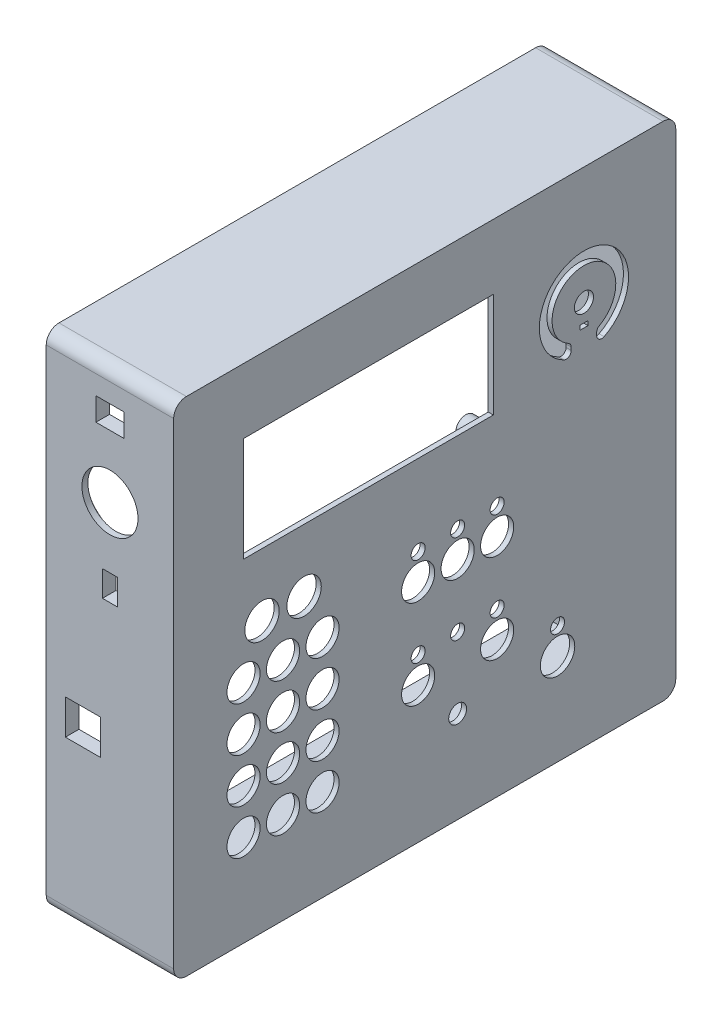
from build123d import *

# Parameters (mm, degrees)
SKETCH1_W           = 197
SKETCH1_H           = 197
BOSS_EXTRUDE1_DEPTH = 50
SKETCH6_W           = 187
SKETCH6_H           = 187
CUT_EXTRUDE1_DEPTH  = 48
SKETCH8_W           = 98
SKETCH8_H           = 41
CUT_EXTRUDE2_DEPTH  = 25
SKETCH9_R           = 4
BOSS_EXTRUDE2_DEPTH = 6.5
FILLET3_R           = 1
SKETCH15_R          = 6.5
SKETCH15_R_2        = 6.75
SKETCH15_R_3        = 2.75
SKETCH15_R_4        = 3.5
CUT_EXTRUDE7_DEPTH  = 10
SKETCH12_R          = 3.75
SKETCH12_W          = 3.2
SKETCH12_H          = 1.7
CUT_EXTRUDE8_DEPTH  = 10
SKETCH18_R          = 11
CUT_EXTRUDE10_DEPTH = 6
SKETCH19_W          = 11
SKETCH19_H          = 9
SKETCH19_W_2        = 5.9
SKETCH19_H_2        = 10.1
CUT_EXTRUDE11_DEPTH = 6
FILLET6_R           = 2
SKETCH21_R          = 2.45
BOSS_EXTRUDE4_DEPTH = 5
FILLET7_R           = 5
SKETCH22_W          = 13.7
SKETCH22_H          = 13.7
CUT_EXTRUDE14_DEPTH = 10
SKETCH27_R          = 15.105421197
CUT_EXTRUDE17_DEPTH = 3
SKETCH28_R          = 2.35
CUT_EXTRUDE18_DEPTH = 6.5


with BuildPart() as part:
    # Sketch1 → Boss-Extrude1 (new body)
    with BuildSketch(Plane(origin=(0, 0, 0), x_dir=(0, 0, -1), z_dir=(1, 0, 0))):
        with Locations((-204.789321881, 0)):
            Rectangle(SKETCH1_W, SKETCH1_H)
    extrude(amount=BOSS_EXTRUDE1_DEPTH)

    # Sketch6 → Cut-Extrude1 (cut)
    with BuildSketch(Plane(origin=(0, 0, 0), x_dir=(0, 0, -1), z_dir=(1, 0, 0))):
        with Locations((-204.449739467, 0)):
            Rectangle(SKETCH6_W, SKETCH6_H)
    extrude(amount=CUT_EXTRUDE1_DEPTH, mode=Mode.SUBTRACT)

    # Sketch8 → Cut-Extrude2 (cut)
    with BuildSketch(Plane.ZY.offset(-48)):
        with Locations((226.869321881, 52.5)):
            Rectangle(SKETCH8_W, SKETCH8_H)
    extrude(amount=-CUT_EXTRUDE2_DEPTH, mode=Mode.SUBTRACT)

    # Sketch9 → Boss-Extrude2 (add)
    with BuildSketch(Plane.ZY.offset(-48)):
        with Locations(Location((180.119321881, 25, 0), (0, 0, 180))):
            Circle(SKETCH9_R)
        with Locations(Location((180.119321881, 80, 0), (0, 0, 180))):
            Circle(SKETCH9_R)
        with Locations(Location((273.619321881, 80, 0), (0, 0, 180))):
            Circle(SKETCH9_R)
        with Locations(Location((273.619321881, 25, 0), (0, 0, 180))):
            Circle(SKETCH9_R)
    extrude(amount=BOSS_EXTRUDE2_DEPTH)

    # Fillet3
    fillet3_edges = [part.edges().sort_by_distance(p)[0] for p in [
        (48, 25, 184.119321881),
        (48, 80, 184.119321881),
        (48, 80, 277.619321881),
        (48, 25, 277.619321881),
    ]]
    fillet(fillet3_edges, radius=FILLET3_R)

    # Sketch15 → Cut-Extrude7 (cut)
    with BuildSketch(Plane(origin=(50, 0, 0), x_dir=(0, 0, -1), z_dir=(1, 0, 0))):
        with Locations((-275.871904419, -62.5)):
            Circle(SKETCH15_R)
        with Locations((-275.871904419, -45)):
            Circle(SKETCH15_R)
        with Locations((-275.871904419, -27.5)):
            Circle(SKETCH15_R)
        with Locations((-275.871904419, -10)):
            Circle(SKETCH15_R)
        with Locations((-260.371904419, -62.5)):
            Circle(SKETCH15_R)
        with Locations((-260.371904419, -45)):
            Circle(SKETCH15_R)
        with Locations((-260.371904419, -27.5)):
            Circle(SKETCH15_R)
        with Locations((-260.371904419, -10)):
            Circle(SKETCH15_R)
        with Locations((-244.871904419, -62.5)):
            Circle(SKETCH15_R)
        with Locations((-244.871904419, -45)):
            Circle(SKETCH15_R)
        with Locations((-244.871904419, -27.5)):
            Circle(SKETCH15_R)
        with Locations((-244.871904419, -10)):
            Circle(SKETCH15_R)
        with Locations((-268.621904419, 7.5)):
            Circle(SKETCH15_R_2)
        with Locations((-252.121904419, 7.5)):
            Circle(SKETCH15_R_2)
        with Locations((-207.371904419, -10)):
            Circle(SKETCH15_R)
        with Locations((-191.871904419, -10)):
            Circle(SKETCH15_R)
        with Locations((-176.371904419, -10)):
            Circle(SKETCH15_R)
        with Locations((-207.371904419, -45)):
            Circle(SKETCH15_R)
        with Locations((-176.371904419, -45)):
            Circle(SKETCH15_R)
        with Locations((-176.371904419, -34.7)):
            Circle(SKETCH15_R_3)
        with Locations((-207.371904419, -34.7)):
            Circle(SKETCH15_R_3)
        with Locations((-207.371904419, 0.3)):
            Circle(SKETCH15_R_3)
        with Locations((-191.871904419, 0.3)):
            Circle(SKETCH15_R_3)
        with Locations((-176.371904419, 0.3)):
            Circle(SKETCH15_R_3)
        with Locations((-152.671904419, -52.2)):
            Circle(SKETCH15_R_3)
        with Locations((-191.871904419, -62.5)):
            Circle(SKETCH15_R_4)
        with Locations((-191.871904419, -34.7)):
            Circle(SKETCH15_R_3)
        with Locations((-152.671904419, -62.5)):
            Circle(SKETCH15_R_2)
    extrude(amount=-CUT_EXTRUDE7_DEPTH, mode=Mode.SUBTRACT)

    # Sketch12 → Cut-Extrude8 (cut)
    with BuildSketch(Plane(origin=(50, 0, 0), x_dir=(0, 0, -1), z_dir=(1, 0, 0))):
        with Locations((-142.319321881, 52.5)):
            Circle(SKETCH12_R)
        with BuildLine():
            Line((-147.319321881, 35.729490169), (-147.319321881, 41.043560763))
            ThreePointArc((-147.319321881, 41.043560763), (-142.319321881, 65), (-137.319321881, 41.043560763))
            Line((-137.319321881, 41.043560763), (-137.319321881, 35.729490169))
            ThreePointArc((-137.319321881, 35.729490169), (-142.319321881, 70), (-147.319321881, 35.729490169))
        make_face()
        with Locations((-142.319321881, 44.65)):
            Rectangle(SKETCH12_W, SKETCH12_H)
    extrude(amount=-CUT_EXTRUDE8_DEPTH, mode=Mode.SUBTRACT)

    # Sketch18 → Cut-Extrude10 (cut)
    with BuildSketch(Plane.XY.offset(303.289321881)):
        with Locations((25, 52.5)):
            Circle(SKETCH18_R)
    extrude(amount=-CUT_EXTRUDE10_DEPTH, mode=Mode.SUBTRACT)

    # Sketch19 → Cut-Extrude11 (cut)
    with BuildSketch(Plane.XY.offset(303.289321881)):
        with Locations((25, 81.5)):
            Rectangle(SKETCH19_W, SKETCH19_H)
        with Locations((25, 23.5)):
            Rectangle(SKETCH19_W_2, SKETCH19_H_2)
    extrude(amount=-CUT_EXTRUDE11_DEPTH, mode=Mode.SUBTRACT)

    # Fillet6
    fillet6_edges = [part.edges().sort_by_distance(p)[0] for p in [
        (49, 35.729490169, 147.319321881),
        (49, 35.729490169, 137.319321881),
        (49, 41.043560763, 137.319321881),
        (49, 41.043560763, 147.319321881),
    ]]
    fillet(fillet6_edges, radius=FILLET6_R)

    # Sketch21 → Boss-Extrude4 (add)
    # profile 1 of 4: a face of its own
    with BuildSketch(Plane.ZY):
        with BuildLine():
            Line((106.289321881, 98.5), (121.289321881, 98.5))
            ThreePointArc((121.289321881, 98.5), (116.895923599, 87.893398282), (106.289321881, 83.5))
            Line((106.289321881, 83.5), (106.289321881, 98.5))
        make_face()
        with Locations((114.289321881, 90.5)):
            Circle(SKETCH21_R, mode=Mode.SUBTRACT)
    # profile 2 of 4: a face of its own
    with BuildSketch(Plane.ZY):
        with BuildLine():
            Line((106.289321881, -98.5), (121.289321881, -98.5))
            ThreePointArc((121.289321881, -98.5), (116.895923599, -87.893398282), (106.289321881, -83.5))
            Line((106.289321881, -83.5), (106.289321881, -98.5))
        make_face()
        with Locations(Location((114.289321881, -90.5, 0), (0, 0, 180))):
            Circle(SKETCH21_R, mode=Mode.SUBTRACT)
    # profile 3 of 4: a face of its own
    with BuildSketch(Plane.ZY):
        with BuildLine():
            Line((303.289321881, -98.5), (288.289321881, -98.5))
            ThreePointArc((288.289321881, -98.5), (292.682720164, -87.893398282), (303.289321881, -83.5))
            Line((303.289321881, -83.5), (303.289321881, -98.5))
        make_face()
        with Locations((295.289321881, -90.5)):
            Circle(SKETCH21_R, mode=Mode.SUBTRACT)
    # profile 4 of 4: a face of its own
    with BuildSketch(Plane.ZY):
        with BuildLine():
            Line((303.289321881, 98.5), (303.289321881, 83.5))
            ThreePointArc((303.289321881, 83.5), (292.682720164, 87.893398282), (288.289321881, 98.5))
            Line((288.289321881, 98.5), (303.289321881, 98.5))
        make_face()
        with Locations(Location((295.289321881, 90.5, 0), (0, 0, 180))):
            Circle(SKETCH21_R, mode=Mode.SUBTRACT)
    extrude(amount=-BOSS_EXTRUDE4_DEPTH)

    # Fillet7
    fillet7_edges = [part.edges().sort_by_distance(p)[0] for p in [
        (25, 98.5, 303.289321881),
        (25, 98.5, 106.289321881),
        (25, -98.5, 106.289321881),
        (25, -98.5, 303.289321881),
    ]]
    fillet(fillet7_edges, radius=FILLET7_R)

    # Sketch22 → Cut-Extrude14 (cut)
    with BuildSketch(Plane.XY.offset(303.289321881)):
        with Locations((14.35, -29.15)):
            Rectangle(SKETCH22_W, SKETCH22_H)
    extrude(amount=-CUT_EXTRUDE14_DEPTH, mode=Mode.SUBTRACT)

    # Sketch27 → Cut-Extrude17 (cut)
    with BuildSketch(Plane(origin=(0, 0, 297.949739467), x_dir=(-1, 0, 0), z_dir=(0, 0, -1))):
        with Locations((-25, 52.5)):
            Circle(SKETCH27_R)
    extrude(amount=-CUT_EXTRUDE17_DEPTH, mode=Mode.SUBTRACT)

    # Sketch28 → Cut-Extrude18 (cut)
    with BuildSketch(Plane.ZY.offset(-48)):
        with Locations(Location((180.119321881, 80, 0), (0, 0, 180))):
            Circle(SKETCH28_R)
        with Locations(Location((180.119321881, 25, 0), (0, 0, 180))):
            Circle(SKETCH28_R)
        with Locations(Location((273.619321881, 80, 0), (0, 0, 180))):
            Circle(SKETCH28_R)
        with Locations(Location((273.619321881, 25, 0), (0, 0, 180))):
            Circle(SKETCH28_R)
    extrude(amount=CUT_EXTRUDE18_DEPTH, mode=Mode.SUBTRACT)


solid = part.part
